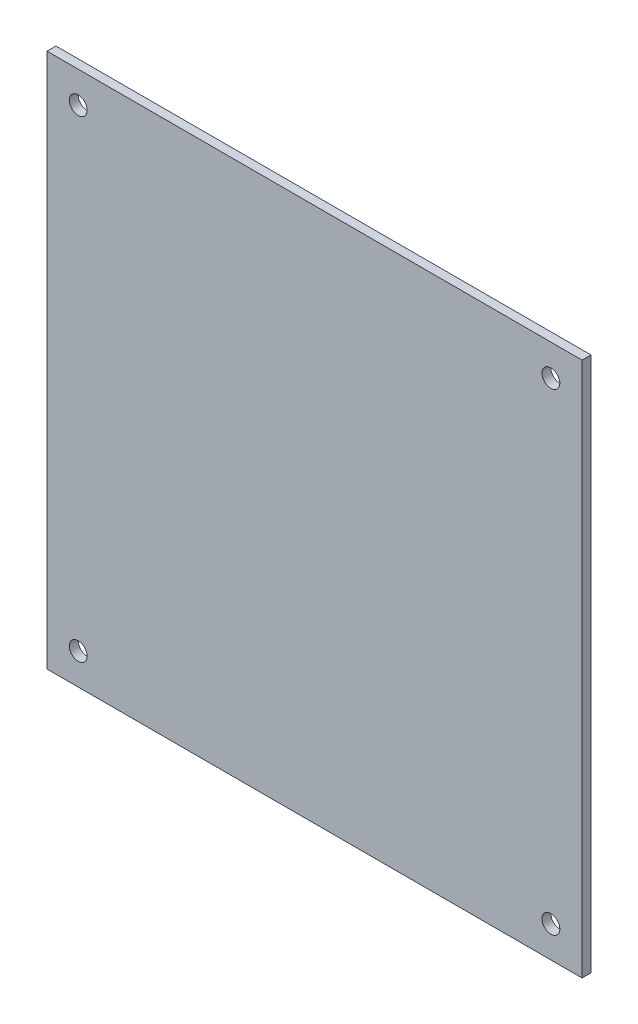
from build123d import *

# Parameters (mm, degrees)
SKETCH1_W           = 300
SKETCH1_H           = 300
SKETCH1_R           = 5
BOSS_EXTRUDE1_DEPTH = 5


with BuildPart() as part:
    # Sketch1 → Boss-Extrude1 (new body)
    with BuildSketch(Plane.XY):
        with Locations((-12.545045045, -68.986486486)):
            Rectangle(SKETCH1_W, SKETCH1_H)
        with Locations((-145.045045045, 63.513513514)):
            Circle(SKETCH1_R, mode=Mode.SUBTRACT)
        with Locations((119.954954955, 63.513513514)):
            Circle(SKETCH1_R, mode=Mode.SUBTRACT)
        with Locations((119.954954955, -201.486486486)):
            Circle(SKETCH1_R, mode=Mode.SUBTRACT)
        with Locations((-145.045045045, -201.486486486)):
            Circle(SKETCH1_R, mode=Mode.SUBTRACT)
    extrude(amount=BOSS_EXTRUDE1_DEPTH)


solid = part.part
